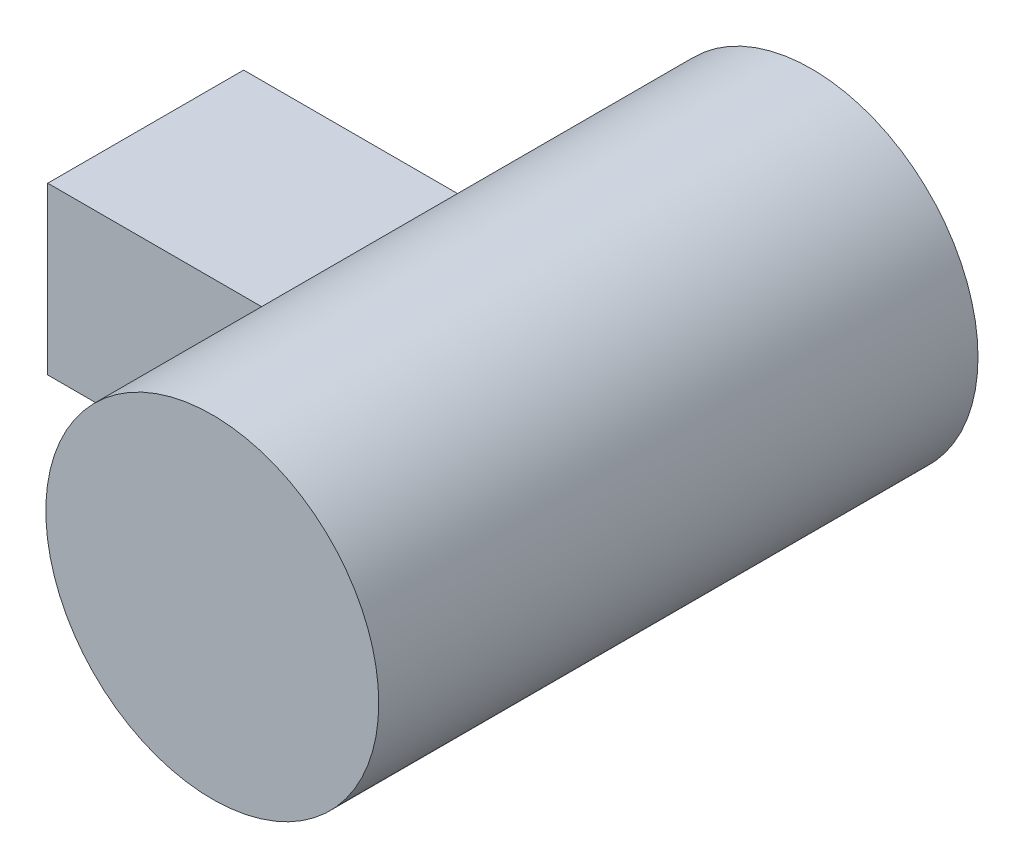
from build123d import *

# Parameters (mm, degrees)
SKETCH1_R           = 31.75
BOSS_EXTRUDE1_DEPTH = 57.15
SKETCH2_W           = 37.368961478
SKETCH2_H           = 31.682380384
BOSS_EXTRUDE2_DEPTH = 69.85


with BuildPart() as part:
    # Sketch1 → Boss-Extrude1 (new, symmetric)
    with BuildSketch(Plane.XY):
        Circle(SKETCH1_R)
    extrude(amount=BOSS_EXTRUDE1_DEPTH, both=True)

    # Sketch2 → Boss-Extrude2 (add)
    with BuildSketch(Plane(origin=(0, 0, 0), x_dir=(0, 0, -1), z_dir=(1, 0, 0))):
        Rectangle(SKETCH2_W, SKETCH2_H)
    extrude(amount=-BOSS_EXTRUDE2_DEPTH)


solid = part.part
